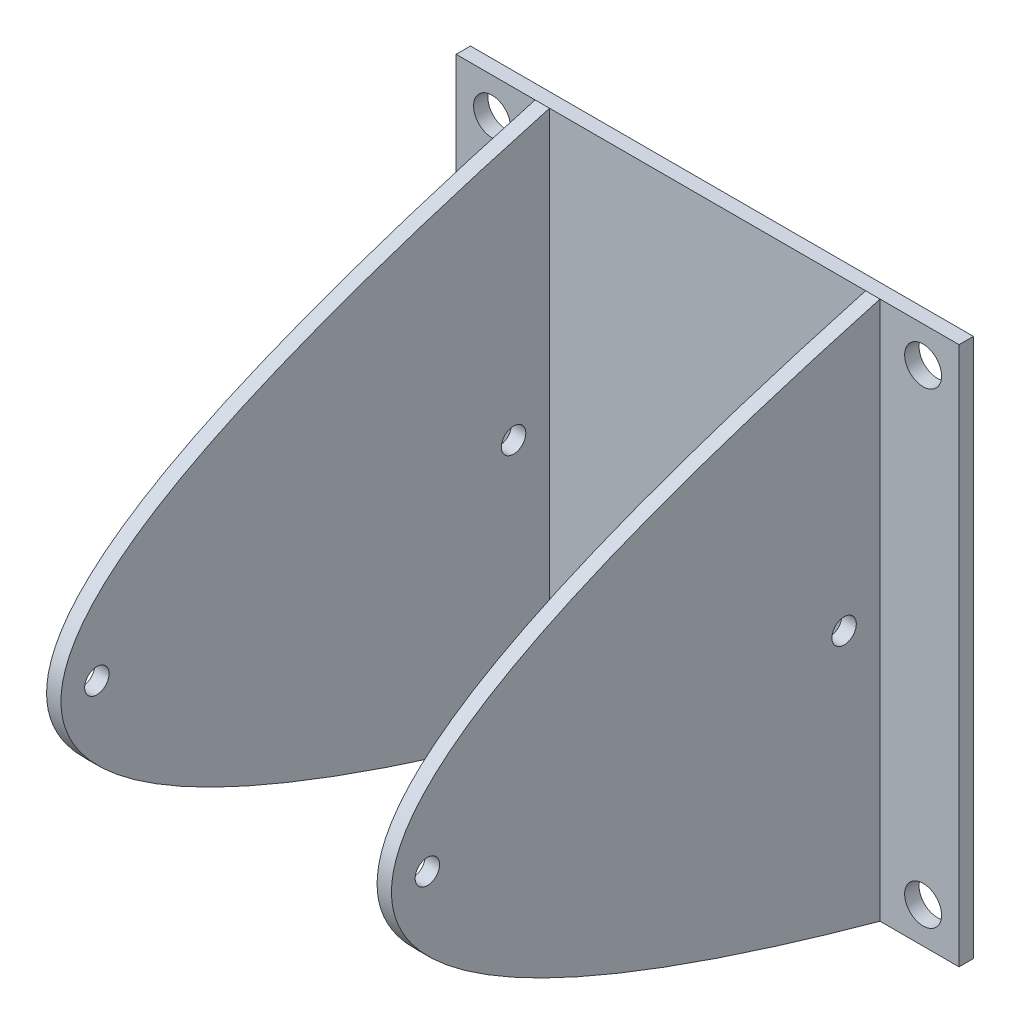
from build123d import *

# Parameters (mm, degrees)
SKETCH1_W           = 88.9
SKETCH1_H           = 95.25
SKETCH1_R           = 3.2639
BOSS_EXTRUDE1_DEPTH = 2.54
SKETCH4_R           = 2.159
BOSS_EXTRUDE2_DEPTH = 2.54


with BuildPart() as part:
    # Sketch1 → Boss-Extrude1 (new body)
    with BuildSketch(Plane.XY):
        Rectangle(SKETCH1_W, SKETCH1_H)
        with Locations((-38.1, -41.275)):
            Circle(SKETCH1_R, mode=Mode.SUBTRACT)
        with Locations((38.1, -41.275)):
            Circle(SKETCH1_R, mode=Mode.SUBTRACT)
        with Locations((38.1, 41.275)):
            Circle(SKETCH1_R, mode=Mode.SUBTRACT)
        with Locations((-38.1, 41.275)):
            Circle(SKETCH1_R, mode=Mode.SUBTRACT)
    extrude(amount=BOSS_EXTRUDE1_DEPTH)

    # Sketch4 → Boss-Extrude2 (add)
    with BuildSketch(Plane(origin=(30.48, 0, 0), x_dir=(0, 0, -1), z_dir=(1, 0, 0))):
        with BuildLine():
            Line((-2.54, 47.625), (-2.54, -47.625))
            add(Edge.make_bspline(
                [(-2.54, 47.625), (-175.26, 0), (-2.54, -47.625)],
                knots=[0, 0, 0, 1, 1, 1], degree=2))
        make_face()
        with Locations((-82.55, 0)):
            Circle(SKETCH4_R, mode=Mode.SUBTRACT)
        with Locations((-8.89, 0)):
            Circle(SKETCH4_R, mode=Mode.SUBTRACT)
    boss_extrude2 = extrude(amount=-BOSS_EXTRUDE2_DEPTH)

    # Mirror1: Boss-Extrude2 across plane
    add(boss_extrude2.mirror(Plane(origin=(0, 0, 0), x_dir=(0, 0, 1), z_dir=(1, 0, 0))))


solid = part.part
